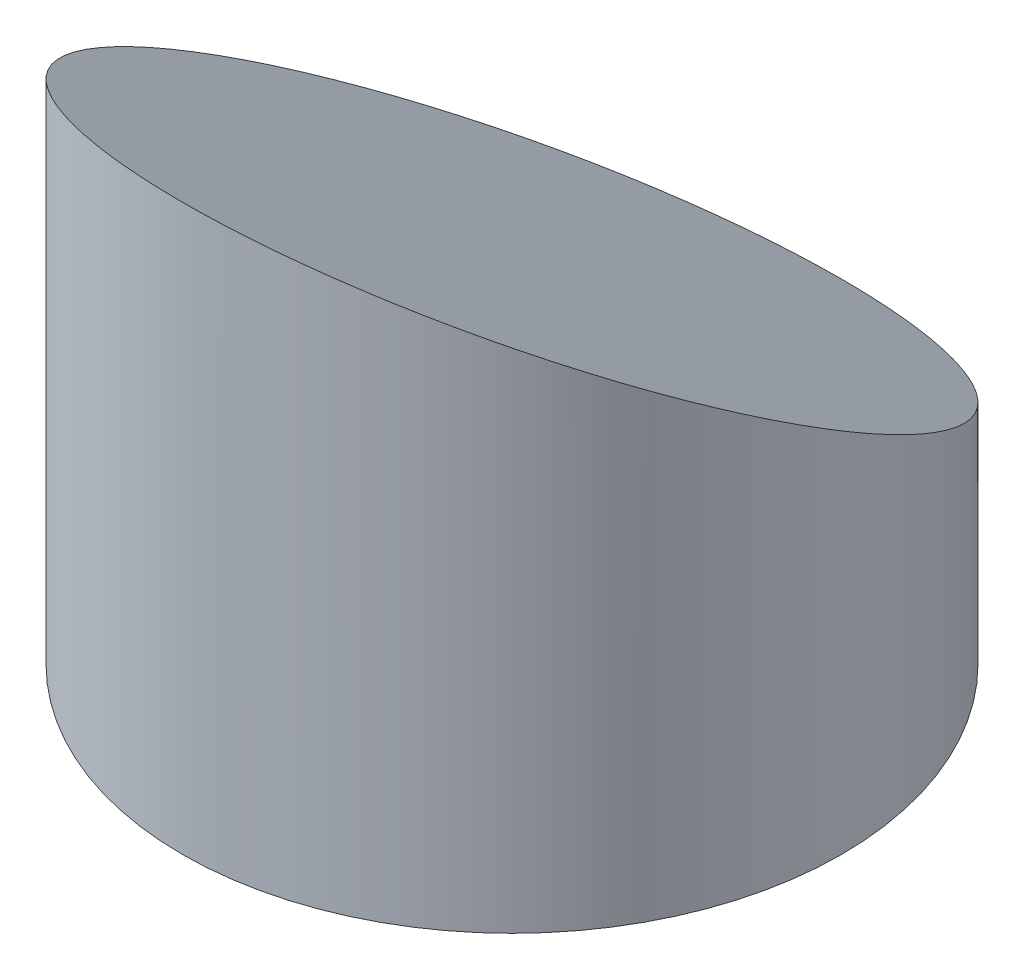
from build123d import *

# Parameters (mm, degrees)
SKETCH1_R               = 3.5
BOSS_EXTRUDE1_DEPTH     = 6
CUT_EXTRUDE1_DEPTH      = 8.778174593
CUT_EXTRUDE1_DEPTH_BACK = 8.778174593


with BuildPart() as part:
    # Sketch1 → Boss-Extrude1 (new body)
    with BuildSketch(Plane(origin=(0, 0, 0), x_dir=(1, 0, 0), z_dir=(0, 1, 0))):
        with Locations(Location((0, 0, 0), (0, 0, 270))):
            Circle(SKETCH1_R)
    extrude(amount=BOSS_EXTRUDE1_DEPTH)

    # Sketch2 → Cut-Extrude1 (cut, two sides: drawn at the far end of the back side and taken through both)
    with BuildSketch(Plane(origin=(0, 0, 0), x_dir=(0, 0, -1), z_dir=(1, 0, 0)).offset(-CUT_EXTRUDE1_DEPTH_BACK)):
        Polygon((-27.877057079, 20.647213607), (-3.5, 6), (3.5, 1.793975667), (27.877057079, -12.85323794), (57.171484293, 35.900876219), (1.417370134, 69.401327765), align=None)
    extrude(amount=CUT_EXTRUDE1_DEPTH + CUT_EXTRUDE1_DEPTH_BACK, mode=Mode.SUBTRACT)


solid = part.part
